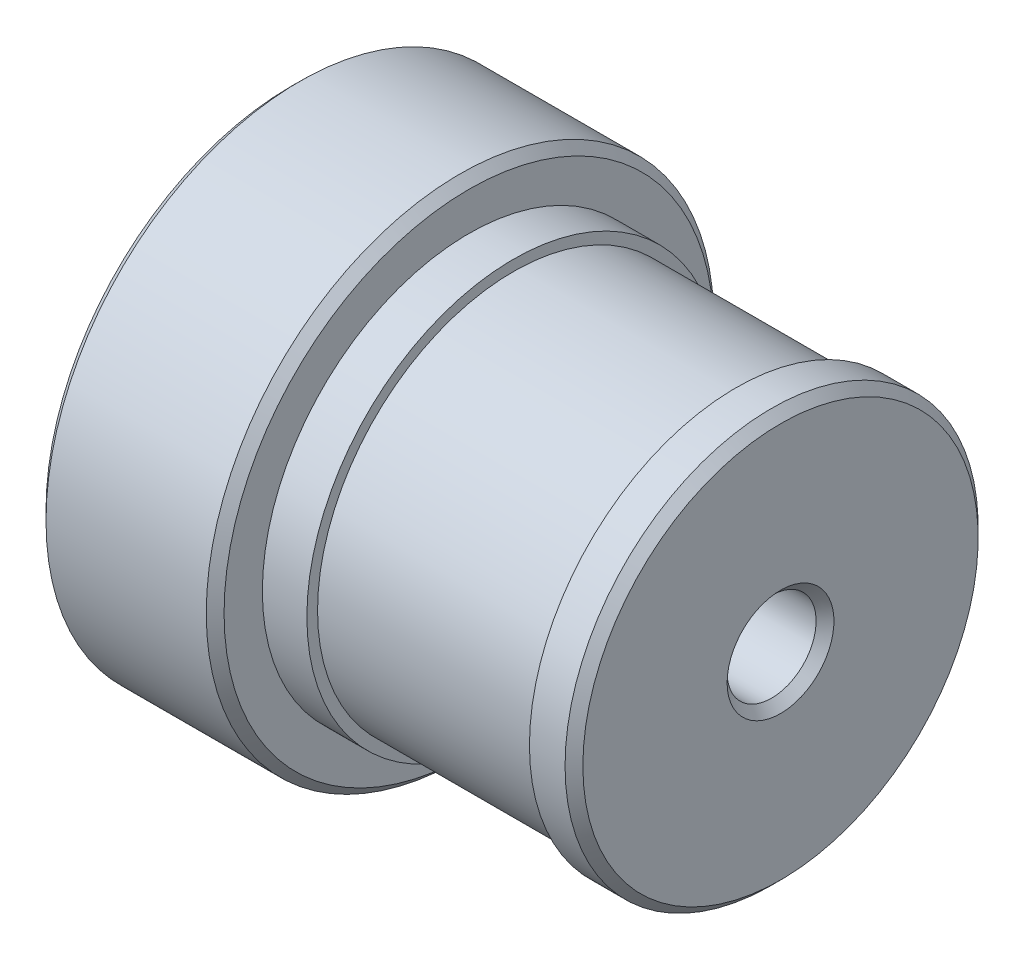
from build123d import *

# Parameters (mm, degrees)
CHAMFER_4_SIZE = 1


with BuildPart() as part:
    # Эскиз1 → Повернуть1 (revolve)
    with BuildSketch(Plane.XY, mode=Mode.PRIVATE) as revolve_1_sk:
        Polygon((0, 5), (0, 28.5), (20, 28.5), (20, 23.2), (25, 23.2), (25, 22), (50, 22), (50, 23.2), (55, 23.2), (55, 5), align=None)
    revolve(revolve_1_sk.sketch.rotate(Axis((0, 0, 0), (1, 0, 0)), 90), axis=Axis((0, 0, 0), (1, 0, 0)))

    # Фаска4
    chamfer_4_edges = [part.edges().sort_by_distance(p)[0] for p in [
        (55, 0, -23.2),
        (55, 0, -5),
        (0, 0, -5),
        (0, 0, -28.5),
        (20, 0, -28.5),
    ]]
    chamfer(chamfer_4_edges, length=CHAMFER_4_SIZE)


solid = part.part
